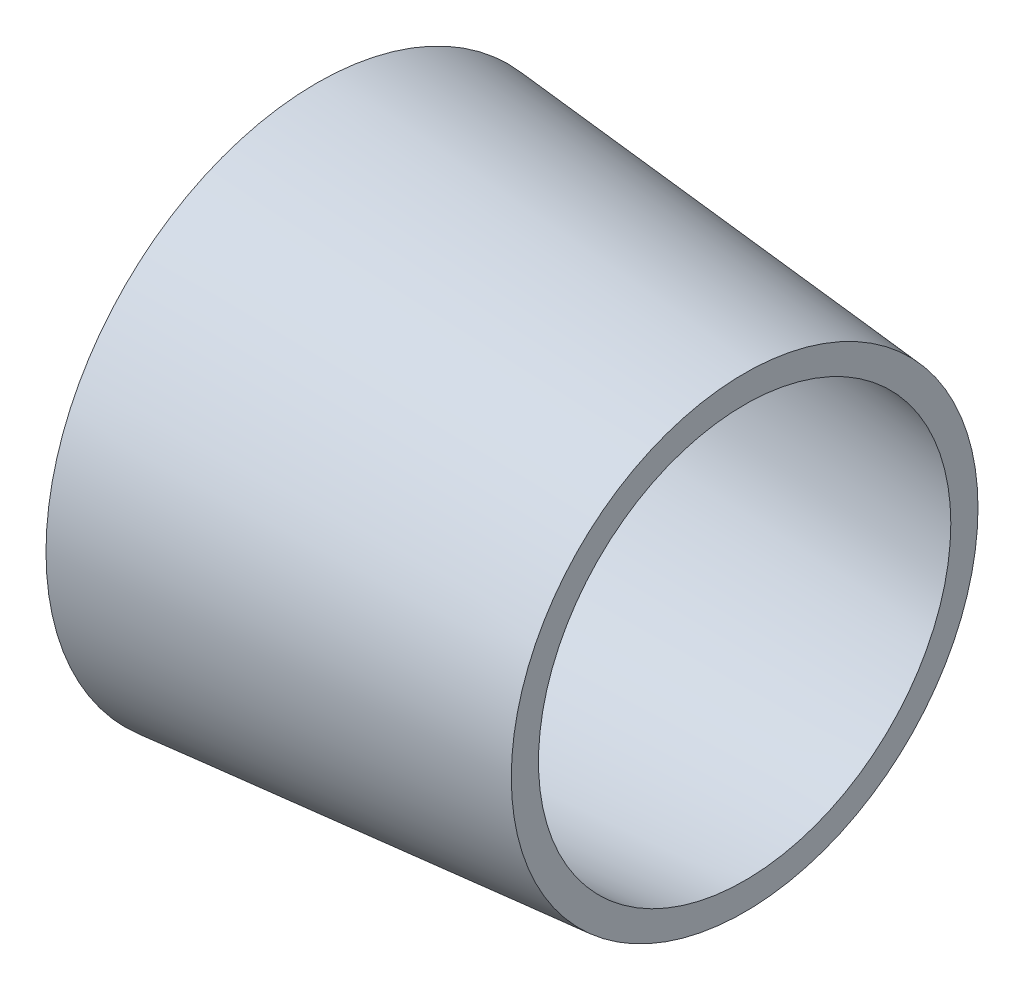
from build123d import *

# Parameters (mm, degrees)
SKETCH1_R           = 25.4
BOSS_EXTRUDE1_DEPTH = 40.132
BOSS_EXTRUDE1_TAPER = 5
SHELL1_T            = -2.54
SCALE1_SCALE        = 18


with BuildPart() as part:
    # Sketch1 → Boss-Extrude1 (new body)
    with BuildSketch(Plane(origin=(0, 0, 0), x_dir=(0, 0, -1), z_dir=(1, 0, 0))):
        Circle(SKETCH1_R)
    extrude(amount=BOSS_EXTRUDE1_DEPTH, taper=BOSS_EXTRUDE1_TAPER)

    # Shell1
    shell1_openings = [part.faces().sort_by_distance(p)[0] for p in [
        (40.132, 0, 0),
    ]]
    offset(amount=SHELL1_T, openings=shell1_openings, kind=Kind.INTERSECTION)


with BuildPart() as part_1:
    # Scale1: scaled about (15.466911265, 0, 0)
    add(part.part.scale(SCALE1_SCALE).moved(Location((-262.937491505, 0, 0))))


solid = part_1.part
